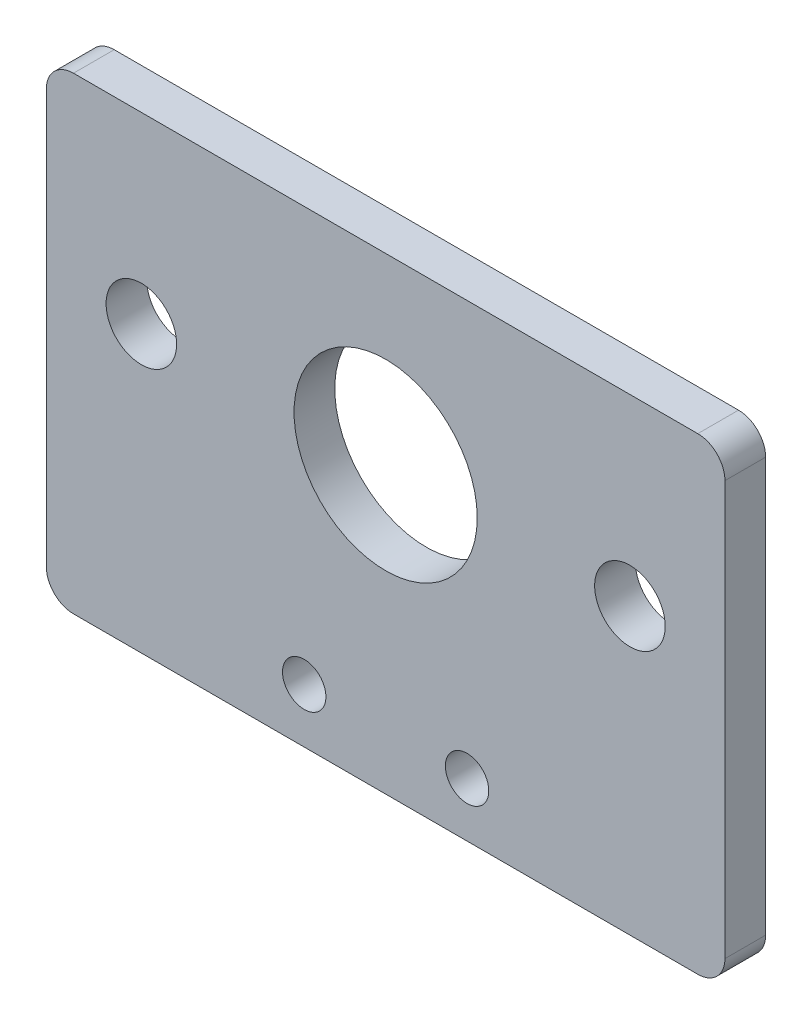
from build123d import *

# Parameters (mm, degrees)
SKETCH_1_R          = 6.75
SKETCH_1_R_2        = 2.6
EXTRUDE_1_DEPTH     = 3
SKETCH_2_R          = 1.6
CUT_EXTRUDE_1_DEPTH = 10
SKETCH_3_W          = 59.357674729
SKETCH_3_H          = 17.816533783
CUT_EXTRUDE_2_DEPTH = 10
FILLET_1_R          = 2


with BuildPart() as part:
    # 草图1 → 凸台-拉伸1 (new body)
    with BuildSketch(Plane.XY):
        with BuildLine():
            Line((2, 0), (48, 0))
            ThreePointArc((48, 0), (49.414213562, -0.585786438), (50, -2))
            Line((50, -2), (50, -40))
            ThreePointArc((50, -40), (49.414213562, -41.414213562), (48, -42))
            Line((48, -42), (2, -42))
            ThreePointArc((2, -42), (0.585786438, -41.414213562), (0, -40))
            Line((0, -40), (0, -2))
            ThreePointArc((0, -2), (0.585786438, -0.585786438), (2, 0))
        make_face()
        with Locations((25, -21)):
            Circle(SKETCH_1_R, mode=Mode.SUBTRACT)
        with Locations((43, -21)):
            Circle(SKETCH_1_R_2, mode=Mode.SUBTRACT)
        with Locations(Location((7, -21, 0), (0, 0, 180))):
            Circle(SKETCH_1_R_2, mode=Mode.SUBTRACT)
    extrude(amount=EXTRUDE_1_DEPTH)

    # 草图2 → 切除-拉伸1 (cut)
    with BuildSketch(Plane(origin=(0, 0, 0), x_dir=(-1, 0, 0), z_dir=(0, 0, -1))):
        with Locations((-19, -38)):
            Circle(SKETCH_2_R)
        with Locations((-31, -38)):
            Circle(SKETCH_2_R)
    extrude(amount=-CUT_EXTRUDE_1_DEPTH, mode=Mode.SUBTRACT)

    # 草图3 → 切除-拉伸2 (cut)
    with BuildSketch(Plane.XY.offset(3)):
        with Locations((23.80492675, 1.408266891)):
            Rectangle(SKETCH_3_W, SKETCH_3_H)
    extrude(amount=-CUT_EXTRUDE_2_DEPTH, mode=Mode.SUBTRACT)

    # 圆角1
    fillet_1_edges = [part.edges().sort_by_distance(p)[0] for p in [
        (50, -7.5, 1.5),
        (0, -7.5, 1.5),
    ]]
    fillet(fillet_1_edges, radius=FILLET_1_R)


solid = part.part
